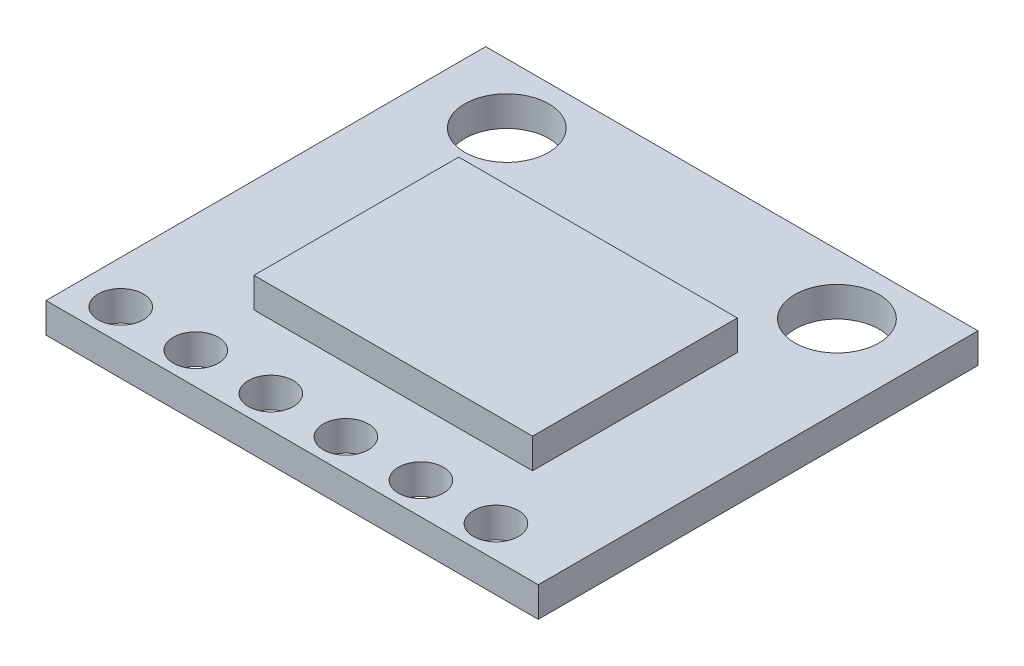
from build123d import *

# Parameters (mm, degrees)
SKETCH1_W           = 16.4
SKETCH1_H           = 14.65
BOSS_EXTRUDE1_DEPTH = 1
SKETCH2_R           = 0.75
SKETCH2_R_2         = 1.4
CUT_EXTRUDE1_DEPTH  = 23.013234656
SKETCH3_W           = 9.281589498
SKETCH3_H           = 6.821714685
BOSS_EXTRUDE2_DEPTH = 1


with BuildPart() as part:
    # Sketch1 → Boss-Extrude1 (new body)
    with BuildSketch(Plane(origin=(0, 0, 0), x_dir=(1, 0, 0), z_dir=(0, 1, 0))):
        with Locations((8.2, 7.325)):
            Rectangle(SKETCH1_W, SKETCH1_H)
    extrude(amount=BOSS_EXTRUDE1_DEPTH)

    # Sketch2 → Cut-Extrude1 (cut, through all)
    with BuildSketch(Plane(origin=(0, 1, 0), x_dir=(1, 0, 0), z_dir=(0, 1, 0))):
        with Locations(Location((1.429004383, 1.061195066, 0), (0, 0, 270))):
            Circle(SKETCH2_R)
        with Locations(Location((3.929004383, 1.061195066, 0), (0, 0, 270))):
            Circle(SKETCH2_R)
        with Locations(Location((6.429004383, 1.061195066, 0), (0, 0, 270))):
            Circle(SKETCH2_R)
        with Locations(Location((8.929004383, 1.061195066, 0), (0, 0, 270))):
            Circle(SKETCH2_R)
        with Locations(Location((11.429004383, 1.061195066, 0), (0, 0, 270))):
            Circle(SKETCH2_R)
        with Locations(Location((13.929004383, 1.061195066, 0), (0, 0, 270))):
            Circle(SKETCH2_R)
        with Locations(Location((2.7, 12.65, 0), (0, 0, 270))):
            Circle(SKETCH2_R_2)
        with Locations(Location((13.7, 12.65, 0), (0, 0, 270))):
            Circle(SKETCH2_R_2)
    extrude(amount=-CUT_EXTRUDE1_DEPTH, mode=Mode.SUBTRACT)

    # Sketch3 → Boss-Extrude2 (add)
    with BuildSketch(Plane(origin=(0, 1, 0), x_dir=(1, 0, 0), z_dir=(0, 1, 0))):
        with Locations((8.377516739, 6.602253277)):
            Rectangle(SKETCH3_W, SKETCH3_H)
    extrude(amount=BOSS_EXTRUDE2_DEPTH)


solid = part.part
